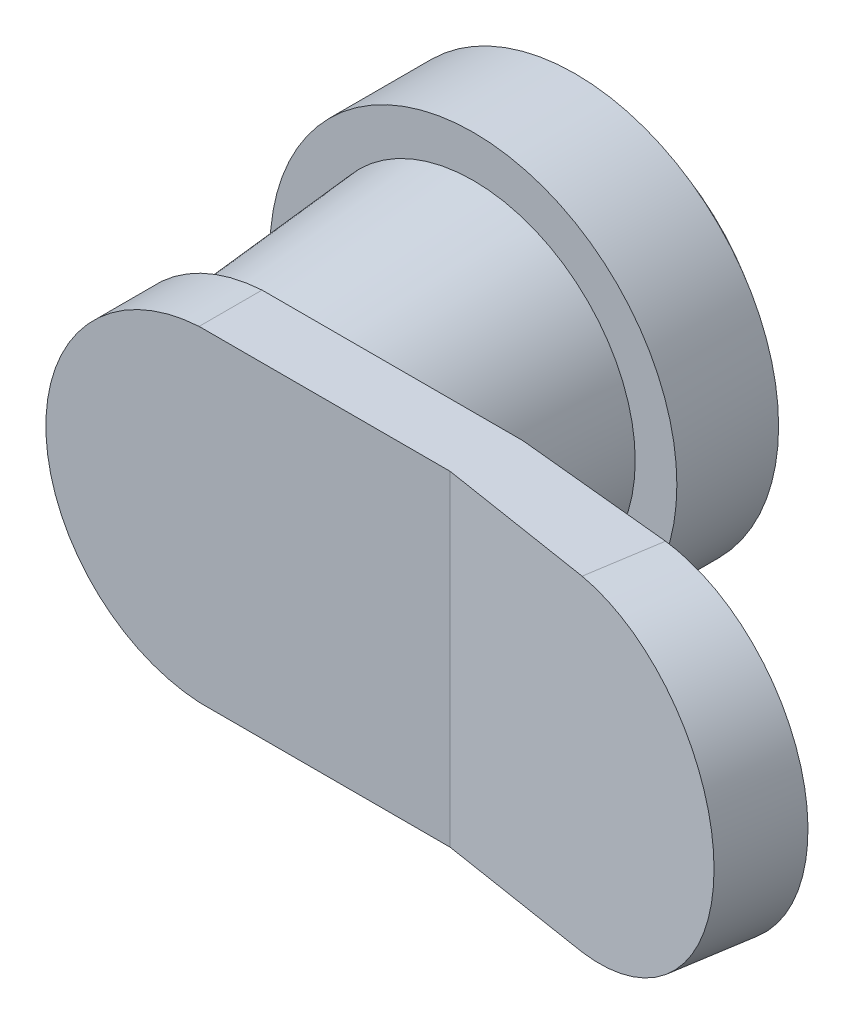
from build123d import *

# Parameters (mm, degrees)
SKETCH_1_R               = 10
EXTRUDE_1_DEPTH          = 5
SKETCH_2_R               = 7.952304339
EXTRUDE_2_DEPTH          = 10
EXTRUDE_2_TAPER          = 5
EXTRUDE_3_DEPTH          = 8
EXTRUDE_3_DEPTH_BACK     = 8
CUT_EXTRUDE_3_DEPTH      = 34.173609497
CUT_EXTRUDE_4_DEPTH      = 36.648067297
CUT_EXTRUDE_4_DEPTH_BACK = 36.648067297
SKETCH_12_R              = 8.616944053
EXTRUDE_4_DEPTH          = 1
SKETCH_13_W              = 5
SKETCH_13_H              = 1
CUT_EXTRUDE_5_DEPTH      = 5


with BuildPart() as part:
    # 草图1 → 拉伸1 (new body)
    with BuildSketch(Plane.XY):
        Circle(SKETCH_1_R)
    extrude(amount=EXTRUDE_1_DEPTH)

    # 草图2 → 拉伸2 (add)
    with BuildSketch(Plane.XY.offset(5)):
        Circle(SKETCH_2_R)
    extrude(amount=EXTRUDE_2_DEPTH, taper=EXTRUDE_2_TAPER)

    # 草图6 → 拉伸3 (add, two sides: drawn at the far end of the back side and taken through both)
    with BuildSketch(Plane(origin=(0, 0, 0), x_dir=(1, 0, 0), z_dir=(0, 1, 0)).offset(-EXTRUDE_3_DEPTH_BACK)):
        Polygon((0, -14.907325308), (-8.038553131, -14.907325308), (-8.038553131, -18), (11.857379423, -18), (27.26622564, -20.43963433), (27.897312043, -16.453662654), (12.347032914, -14.907325308), align=None)
    extrude(amount=EXTRUDE_3_DEPTH + EXTRUDE_3_DEPTH_BACK)

    # 草图10 → 切除-拉伸3 (cut, through all)
    with BuildSketch(Plane(origin=(0, 0, 14.907325308), x_dir=(-1, 0, 0), z_dir=(0, 0, -1))):
        with BuildLine():
            Line((8.038553131, 8), (0.481598082, 8))
            ThreePointArc((0.481598082, 8), (8.014482935, 0), (0.481598082, -8))
            Line((0.481598082, -8), (8.038553131, -8))
            Line((8.038553131, -8), (8.038553131, 8))
        make_face()
    extrude(amount=-CUT_EXTRUDE_3_DEPTH, mode=Mode.SUBTRACT)

    # 草图11 → 切除-拉伸4 (cut, two sides: drawn at the far end of the back side and taken through both)
    with BuildSketch(Plane(origin=(-2.490226462, 0, 15.728388526), x_dir=(0.9876971253210124, 0, 0.15637899038108757), z_dir=(-0.15637899038108757, 0, 0.9876971253210124)).offset(-CUT_EXTRUDE_4_DEPTH_BACK)):
        with BuildLine():
            Line((30.127102063, 8), (22.32671173, 8))
            ThreePointArc((22.32671173, 8), (27.854238113, 5.586727337), (30.127102063, 0))
            Line((30.127102063, 0), (30.127102063, 8))
        make_face()
        with BuildLine():
            Line((30.127102063, -8), (30.127102063, 0))
            ThreePointArc((30.127102063, 0), (27.854238113, -5.586727337), (22.32671173, -8))
            Line((22.32671173, -8), (30.127102063, -8))
        make_face()
    extrude(amount=CUT_EXTRUDE_4_DEPTH + CUT_EXTRUDE_4_DEPTH_BACK, mode=Mode.SUBTRACT)

    # 草图12 → 拉伸4 (add)
    with BuildSketch(Plane(origin=(0, 0, 0), x_dir=(-1, 0, 0), z_dir=(0, 0, -1))):
        with Locations(Location((0, 0, 0), (0, 0, 180))):
            Circle(SKETCH_12_R)
    extrude(amount=EXTRUDE_4_DEPTH)

    # 草图13 → 切除-拉伸5 (cut)
    with BuildSketch(Plane(origin=(0, 0, -1), x_dir=(-1, 0, 0), z_dir=(0, 0, -1))):
        Rectangle(SKETCH_13_W, SKETCH_13_H)
    extrude(amount=-CUT_EXTRUDE_5_DEPTH, mode=Mode.SUBTRACT)


solid = part.part
